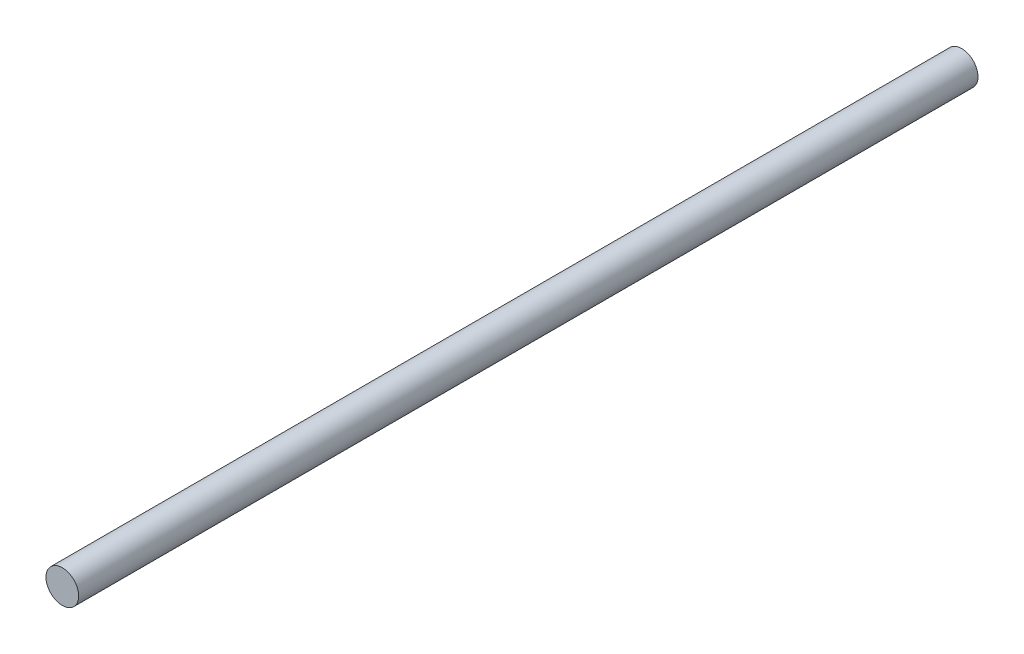
from build123d import *

# Parameters (mm, degrees)
SKETCH1_R           = 4
BOSS_EXTRUDE1_DEPTH = 220


with BuildPart() as part:
    # Sketch1 → Boss-Extrude1 (new body)
    with BuildSketch(Plane(origin=(0, 0, 0), x_dir=(0, 1, 0), z_dir=(0, 0, 1))):
        with Locations(Location((0, 0, 0), (0, 0, 270))):
            Circle(SKETCH1_R)
    extrude(amount=BOSS_EXTRUDE1_DEPTH)


solid = part.part
